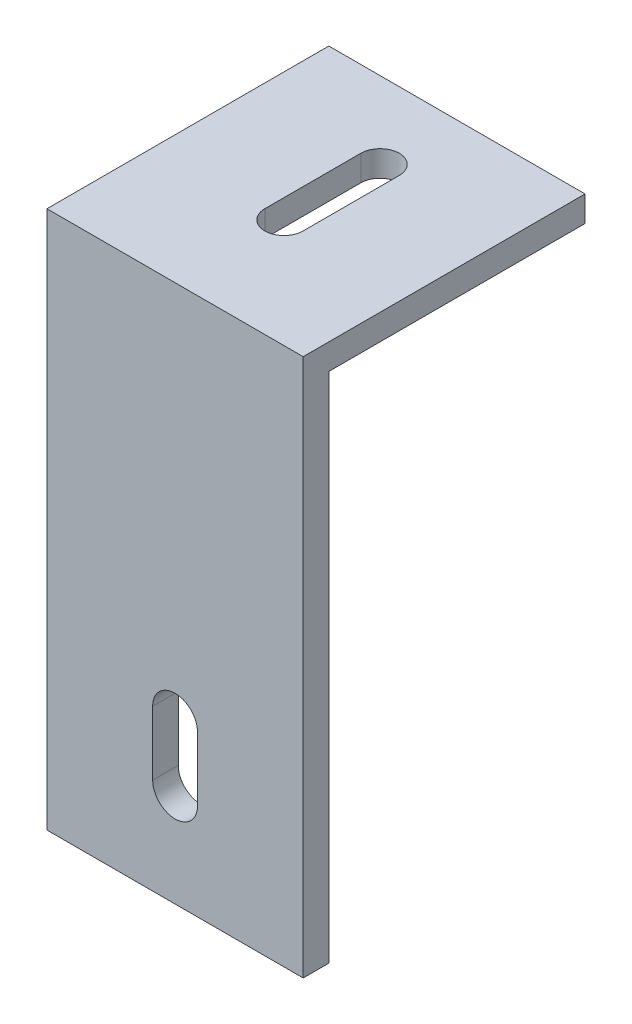
from build123d import *

# Parameters (mm, degrees)
EXTRUDE_1_DEPTH     = 40
CUT_EXTRUDE_1_REACH = 104.917
CUT_EXTRUDE_2_REACH = 104.917


with BuildPart() as part:
    # 草图1 → 凸台-拉伸1 (new body)
    with BuildSketch(Plane(origin=(0, 0, 0), x_dir=(0, 0, -1), z_dir=(1, 0, 0))):
        Polygon((0, 0), (0, 84), (44, 84), (44, 80), (4, 80), (4, 0), align=None)
    extrude(amount=EXTRUDE_1_DEPTH)

    # 草图2 → 切除-拉伸1 (cut, up to next)
    with BuildSketch(Plane(origin=(0, 84, 0), x_dir=(1, 0, 0), z_dir=(0, 1, 0)), mode=Mode.PRIVATE) as cut_extrude_1_sk1:
        with BuildLine():
            Line((17, 32), (17, 17))
            ThreePointArc((17, 17), (20, 14), (23, 17))
            Line((23, 17), (23, 32))
            ThreePointArc((23, 32), (20, 35), (17, 32))
        make_face()
    cut_extrude_1_tool1 = extrude(cut_extrude_1_sk1.sketch, amount=-CUT_EXTRUDE_1_REACH, mode=Mode.PRIVATE) & part.part
    add(cut_extrude_1_tool1.solids().sort_by_distance((20, 84, -24.5))[0], mode=Mode.SUBTRACT)

    # 草图3 → 切除-拉伸2 (cut, up to next)
    with BuildSketch(Plane.XY, mode=Mode.PRIVATE) as cut_extrude_2_sk1:
        with BuildLine():
            Line((23.5, 15), (23.5, 25))
            ThreePointArc((23.5, 25), (20, 28.5), (16.5, 25))
            Line((16.5, 25), (16.5, 15))
            ThreePointArc((16.5, 15), (20, 11.5), (23.5, 15))
        make_face()
    cut_extrude_2_tool1 = extrude(cut_extrude_2_sk1.sketch, amount=-CUT_EXTRUDE_2_REACH, mode=Mode.PRIVATE) & part.part
    add(cut_extrude_2_tool1.solids().sort_by_distance((20, 20, 0))[0], mode=Mode.SUBTRACT)


solid = part.part
